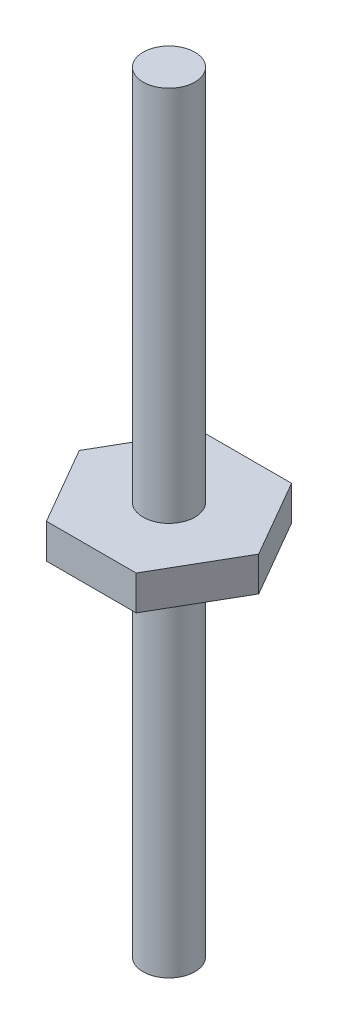
from build123d import *

# Parameters (mm, degrees)
SKETCH1_R           = 1.5
BOSS_EXTRUDE1_DEPTH = 23.825
BOSS_EXTRUDE2_DEPTH = 2
BOSS_EXTRUDE3_START = 20.8
SKETCH4_R           = 1.5
BOSS_EXTRUDE3_DEPTH = 20.8


with BuildPart() as part:
    # Sketch1 → Boss-Extrude1 (new body)
    with BuildSketch(Plane(origin=(0, 0, 0), x_dir=(1, 0, 0), z_dir=(0, 1, 0))):
        with Locations(Location((0, 0, 0), (0, 0, 270))):
            Circle(SKETCH1_R)
    extrude(amount=BOSS_EXTRUDE1_DEPTH)

    # Sketch3 → Boss-Extrude2 (add)
    with BuildSketch(Plane(origin=(0, 0, 0), x_dir=(-1, 0, 0), z_dir=(0, -1, 0))):
        Polygon((5.196152423, 0), (2.598076211, 4.5), (-2.598076211, 4.5), (-5.196152423, 0), (-2.598076211, -4.5), (2.598076211, -4.5), align=None)
    extrude(amount=-BOSS_EXTRUDE2_DEPTH)

    # Sketch4 → Boss-Extrude3 (add)
    with BuildSketch(Plane(origin=(0, 0, 0), x_dir=(-1, 0, 0), z_dir=(0, -1, 0)).offset(BOSS_EXTRUDE3_START)):
        with Locations(Location((0, 0, 0), (0, 0, 90))):
            Circle(SKETCH4_R)
    extrude(amount=-BOSS_EXTRUDE3_DEPTH)


solid = part.part
